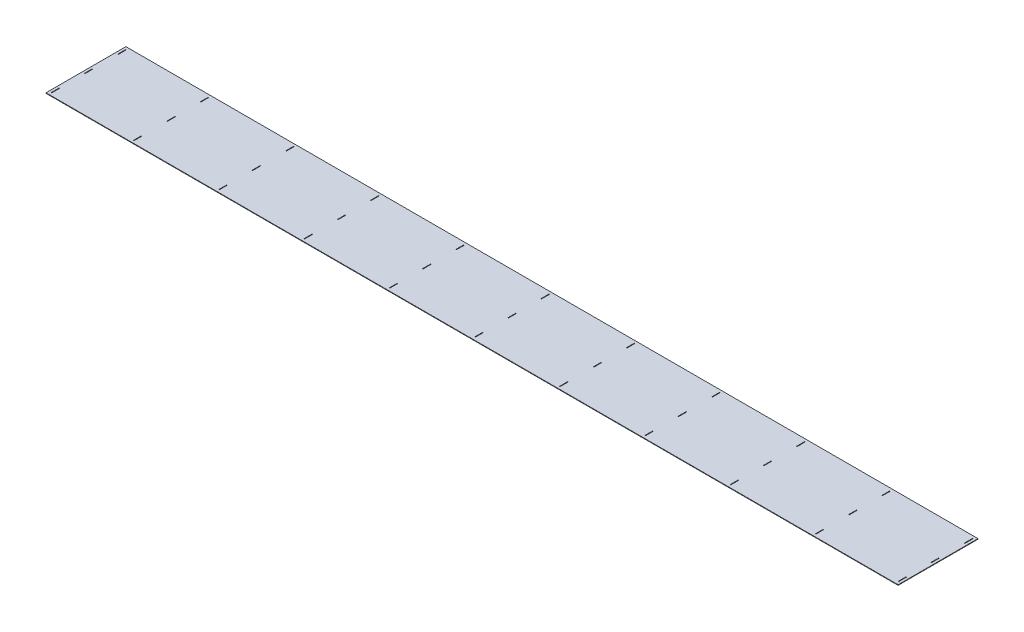
from build123d import *

# Parameters (mm, degrees)
SKETCH1_W           = 1600
SKETCH1_H           = 150
SKETCH1_W_2         = 1
SKETCH1_H_2         = 15
BOSS_EXTRUDE1_DEPTH = 1


with BuildPart() as part:
    # Sketch1 → Boss-Extrude1 (new body)
    with BuildSketch(Plane(origin=(0, 0, 0), x_dir=(1, 0, 0), z_dir=(0, 1, 0))):
        Rectangle(SKETCH1_W, SKETCH1_H)
        with Locations((-795, 62.5)):
            Rectangle(SKETCH1_W_2, SKETCH1_H_2, mode=Mode.SUBTRACT)
        with Locations((-795, 0)):
            Rectangle(SKETCH1_W_2, SKETCH1_H_2, mode=Mode.SUBTRACT)
        with Locations((-795, -62.5)):
            Rectangle(SKETCH1_W_2, SKETCH1_H_2, mode=Mode.SUBTRACT)
        with Locations((0, 62.5)):
            Rectangle(SKETCH1_W_2, SKETCH1_H_2, mode=Mode.SUBTRACT)
        Rectangle(SKETCH1_W_2, SKETCH1_H_2, mode=Mode.SUBTRACT)
        with Locations((0, -62.5)):
            Rectangle(SKETCH1_W_2, SKETCH1_H_2, mode=Mode.SUBTRACT)
        with Locations((160, -62.5)):
            Rectangle(SKETCH1_W_2, SKETCH1_H_2, mode=Mode.SUBTRACT)
        with Locations((795, 62.5)):
            Rectangle(SKETCH1_W_2, SKETCH1_H_2, mode=Mode.SUBTRACT)
        with Locations((795, 0)):
            Rectangle(SKETCH1_W_2, SKETCH1_H_2, mode=Mode.SUBTRACT)
        with Locations((795, -62.5)):
            Rectangle(SKETCH1_W_2, SKETCH1_H_2, mode=Mode.SUBTRACT)
        with Locations((160, 0)):
            Rectangle(SKETCH1_W_2, SKETCH1_H_2, mode=Mode.SUBTRACT)
        with Locations((160, 62.5)):
            Rectangle(SKETCH1_W_2, SKETCH1_H_2, mode=Mode.SUBTRACT)
        with Locations((320, -62.5)):
            Rectangle(SKETCH1_W_2, SKETCH1_H_2, mode=Mode.SUBTRACT)
        with Locations((320, 0)):
            Rectangle(SKETCH1_W_2, SKETCH1_H_2, mode=Mode.SUBTRACT)
        with Locations((320, 62.5)):
            Rectangle(SKETCH1_W_2, SKETCH1_H_2, mode=Mode.SUBTRACT)
        with Locations((480, -62.5)):
            Rectangle(SKETCH1_W_2, SKETCH1_H_2, mode=Mode.SUBTRACT)
        with Locations((480, 0)):
            Rectangle(SKETCH1_W_2, SKETCH1_H_2, mode=Mode.SUBTRACT)
        with Locations((480, 62.5)):
            Rectangle(SKETCH1_W_2, SKETCH1_H_2, mode=Mode.SUBTRACT)
        with Locations((640, -62.5)):
            Rectangle(SKETCH1_W_2, SKETCH1_H_2, mode=Mode.SUBTRACT)
        with Locations((640, 0)):
            Rectangle(SKETCH1_W_2, SKETCH1_H_2, mode=Mode.SUBTRACT)
        with Locations((640, 62.5)):
            Rectangle(SKETCH1_W_2, SKETCH1_H_2, mode=Mode.SUBTRACT)
        with Locations((-160, -62.5)):
            Rectangle(SKETCH1_W_2, SKETCH1_H_2, mode=Mode.SUBTRACT)
        with Locations((-160, 0)):
            Rectangle(SKETCH1_W_2, SKETCH1_H_2, mode=Mode.SUBTRACT)
        with Locations((-160, 62.5)):
            Rectangle(SKETCH1_W_2, SKETCH1_H_2, mode=Mode.SUBTRACT)
        with Locations((-320, -62.5)):
            Rectangle(SKETCH1_W_2, SKETCH1_H_2, mode=Mode.SUBTRACT)
        with Locations((-320, 0)):
            Rectangle(SKETCH1_W_2, SKETCH1_H_2, mode=Mode.SUBTRACT)
        with Locations((-320, 62.5)):
            Rectangle(SKETCH1_W_2, SKETCH1_H_2, mode=Mode.SUBTRACT)
        with Locations((-480, -62.5)):
            Rectangle(SKETCH1_W_2, SKETCH1_H_2, mode=Mode.SUBTRACT)
        with Locations((-480, 0)):
            Rectangle(SKETCH1_W_2, SKETCH1_H_2, mode=Mode.SUBTRACT)
        with Locations((-480, 62.5)):
            Rectangle(SKETCH1_W_2, SKETCH1_H_2, mode=Mode.SUBTRACT)
        with Locations((-640, -62.5)):
            Rectangle(SKETCH1_W_2, SKETCH1_H_2, mode=Mode.SUBTRACT)
        with Locations((-640, 0)):
            Rectangle(SKETCH1_W_2, SKETCH1_H_2, mode=Mode.SUBTRACT)
        with Locations((-640, 62.5)):
            Rectangle(SKETCH1_W_2, SKETCH1_H_2, mode=Mode.SUBTRACT)
    extrude(amount=BOSS_EXTRUDE1_DEPTH)


solid = part.part
